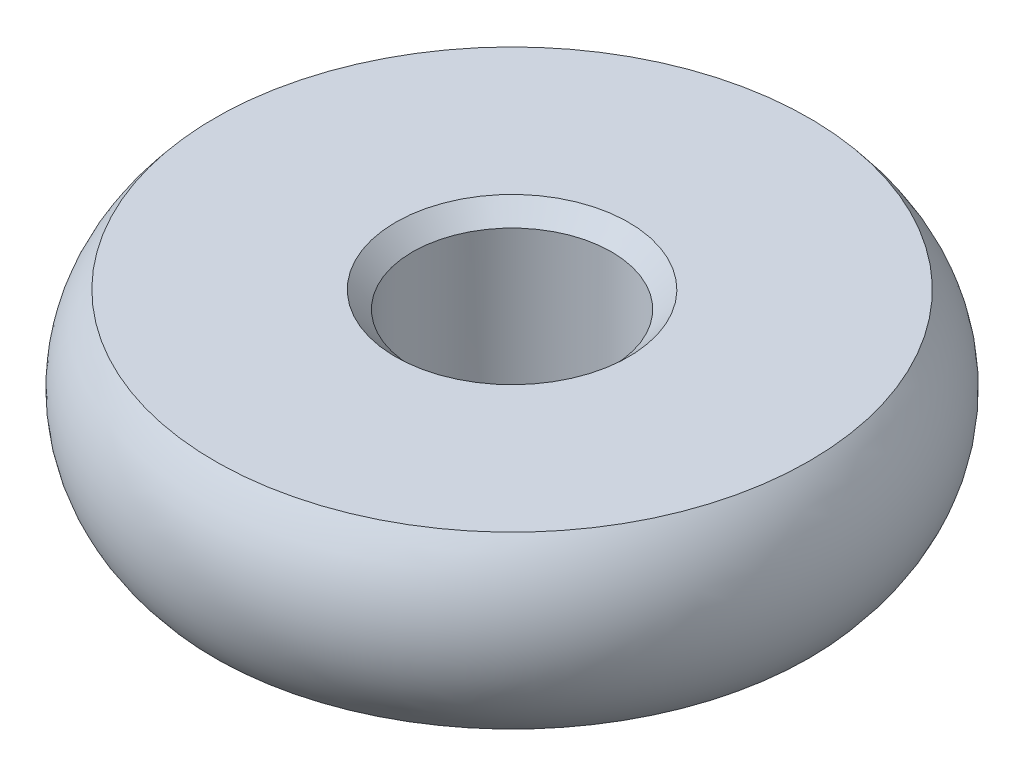
from build123d import *

# Parameters (mm, degrees)
CHAMFER1_SIZE = 3


with BuildPart() as part:
    # Sketch1 → Revolve1 (revolve)
    with BuildSketch(Plane.XY):
        with BuildLine():
            Line((17.5, 15), (17.5, -15))
            Line((17.5, -15), (52.270509831, -15))
            ThreePointArc((52.270509831, -15), (58, 0), (52.270509831, 15))
            Line((52.270509831, 15), (17.5, 15))
        make_face()
    revolve(axis=Axis((0, -562.822725834, 0), (0, 1, 0)))

    # Chamfer1
    chamfer1_edges = [part.edges().sort_by_distance(p)[0] for p in [
        (-17.5, 15, 0),
        (-17.5, -15, 0),
    ]]
    chamfer(chamfer1_edges, length=CHAMFER1_SIZE)


solid = part.part
